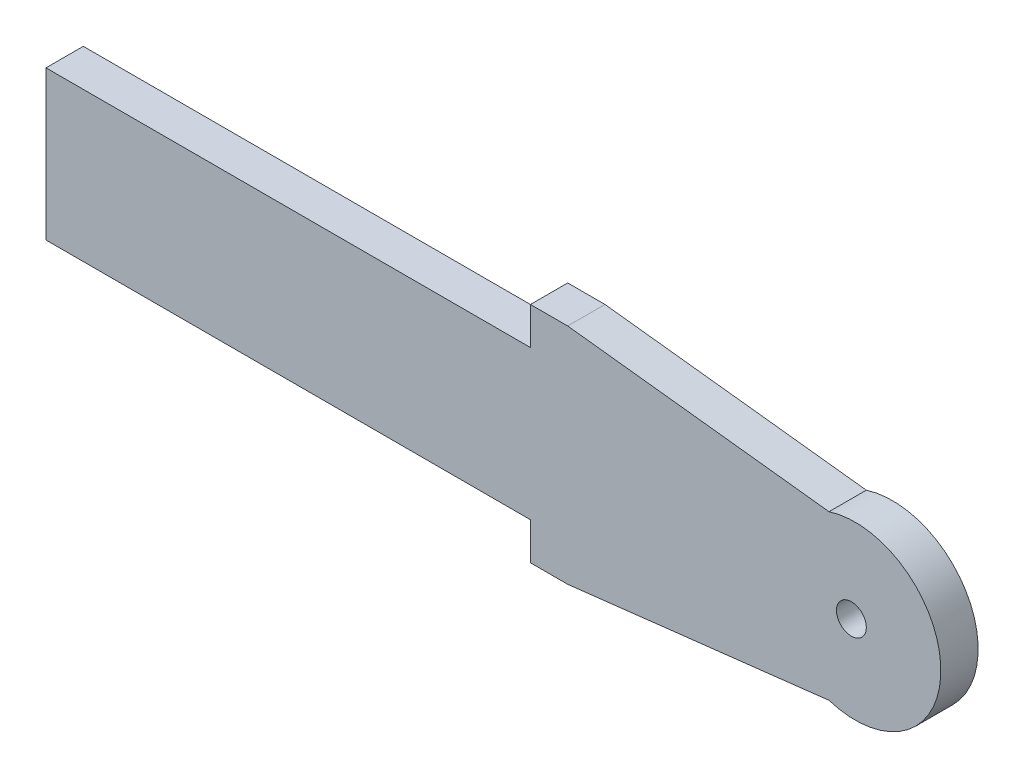
from build123d import *

# Parameters (mm, degrees)
SKETCH_1_W          = 240
SKETCH_1_H          = 60
EXTRUDE_1_DEPTH     = 10
SKETCH_2_W          = 129.92
SKETCH_2_H          = 10
CUT_EXTRUDE_2_DEPTH = 10
SKETCH_3_R          = 4
CUT_EXTRUDE_3_DEPTH = 10


with BuildPart() as part:
    # 草图1 → 凸台-拉伸1 (new body)
    with BuildSketch(Plane.XY):
        Rectangle(SKETCH_1_W, SKETCH_1_H)
    extrude(amount=EXTRUDE_1_DEPTH)

    # 草图2 → 切除-拉伸2 (cut)
    with BuildSketch(Plane.XY.offset(10)):
        Polygon((90, 30), (19.92, 30), (90, 21.9089023), align=None)
        with BuildLine():
            Line((90, 30), (90, 21.9089023))
            ThreePointArc((90, 21.9089023), (110.564659966, 18.574175621), (120, 0))
            Line((120, 0), (120, 30))
            Line((120, 30), (90, 30))
        make_face()
        with BuildLine():
            ThreePointArc((120, 0), (110.564659966, -18.574175621), (90, -21.9089023))
            Line((90, -21.9089023), (90, -30))
            Line((90, -30), (120, -30))
            Line((120, -30), (120, 0))
        make_face()
        Polygon((90, -21.9089023), (19.92, -30), (90, -30), align=None)
        with Locations((-55.04, 25)):
            Rectangle(SKETCH_2_W, SKETCH_2_H)
        with Locations((-55.04, -25)):
            Rectangle(SKETCH_2_W, SKETCH_2_H)
    extrude(amount=-CUT_EXTRUDE_2_DEPTH, mode=Mode.SUBTRACT)

    # 草图3 → 切除-拉伸3 (cut)
    with BuildSketch(Plane.XY.offset(10)):
        with Locations((96, 0)):
            Circle(SKETCH_3_R)
    extrude(amount=-CUT_EXTRUDE_3_DEPTH, mode=Mode.SUBTRACT)


solid = part.part
